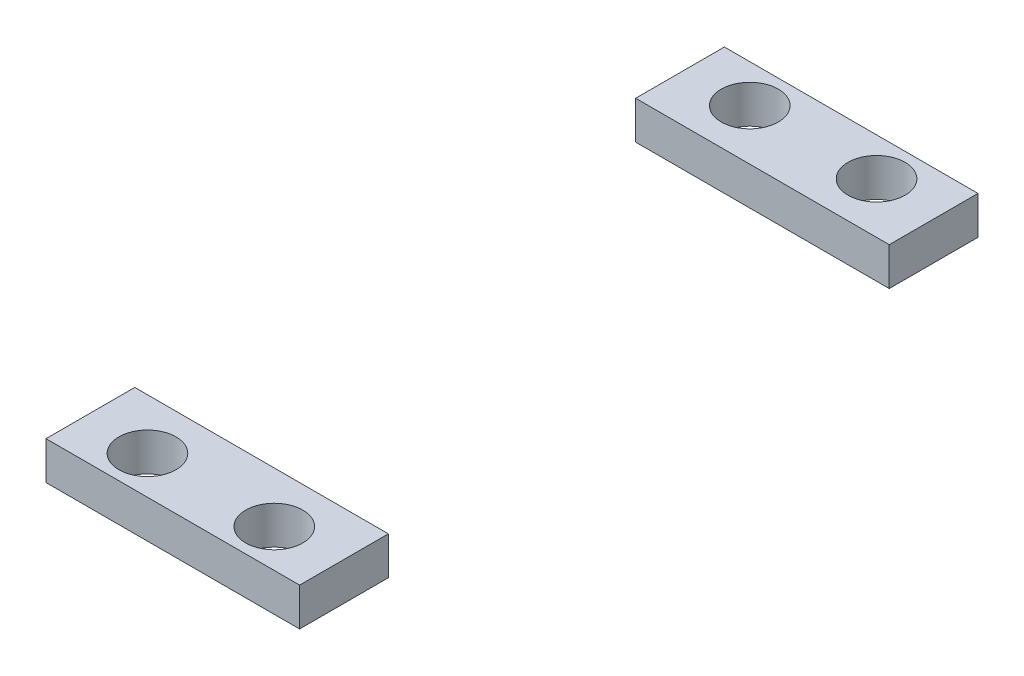
from build123d import *

# Parameters (mm, degrees)
SKETCH1_W             = 20
SKETCH1_H             = 7
SKETCH1_R             = 2.25
BOSS_EXTRUDE2_DEPTH   = 3
BOSS_EXTRUDE2_2_DEPTH = 3


with BuildPart() as part:
    # Sketch1 → Boss-Extrude2 (new body)
    with BuildSketch(Plane(origin=(0, 0, 0), x_dir=(1, 0, 0), z_dir=(0, 1, 0))):
        with Locations((10, 50)):
            Rectangle(SKETCH1_W, SKETCH1_H)
        with Locations(Location((5, 50.5, 0), (0, 0, 270))):
            Circle(SKETCH1_R, mode=Mode.SUBTRACT)
        with Locations(Location((15, 50.5, 0), (0, 0, 270))):
            Circle(SKETCH1_R, mode=Mode.SUBTRACT)
    extrude(amount=BOSS_EXTRUDE2_DEPTH)


with BuildPart() as body_2:
    # Sketch1 → Boss-Extrude2 2 (new body)
    with BuildSketch(Plane(origin=(0, 0, 0), x_dir=(1, 0, 0), z_dir=(0, 1, 0))):
        with Locations((10, 3.5)):
            Rectangle(SKETCH1_W, SKETCH1_H)
        with Locations(Location((5, 3, 0), (0, 0, 270))):
            Circle(SKETCH1_R, mode=Mode.SUBTRACT)
        with Locations(Location((15, 3, 0), (0, 0, 270))):
            Circle(SKETCH1_R, mode=Mode.SUBTRACT)
    extrude(amount=BOSS_EXTRUDE2_2_DEPTH)


solid = Compound([part.part, body_2.part])
